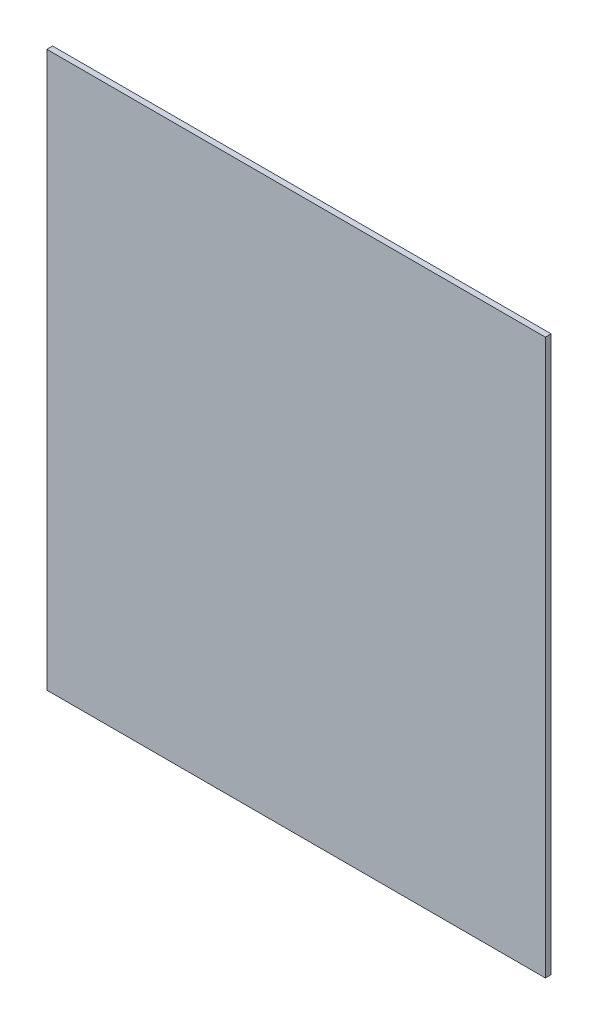
from build123d import *

# Parameters (mm, degrees)
CROQUIS1_W              = 260.5
CROQUIS1_H              = 290
SALIENTE_EXTRUIR1_DEPTH = 3


with BuildPart() as part:
    # Croquis1 → Saliente-Extruir1 (new body)
    with BuildSketch(Plane.XY):
        with Locations((13.857007726, -35.428375912)):
            Rectangle(CROQUIS1_W, CROQUIS1_H)
    extrude(amount=SALIENTE_EXTRUIR1_DEPTH)


solid = part.part
